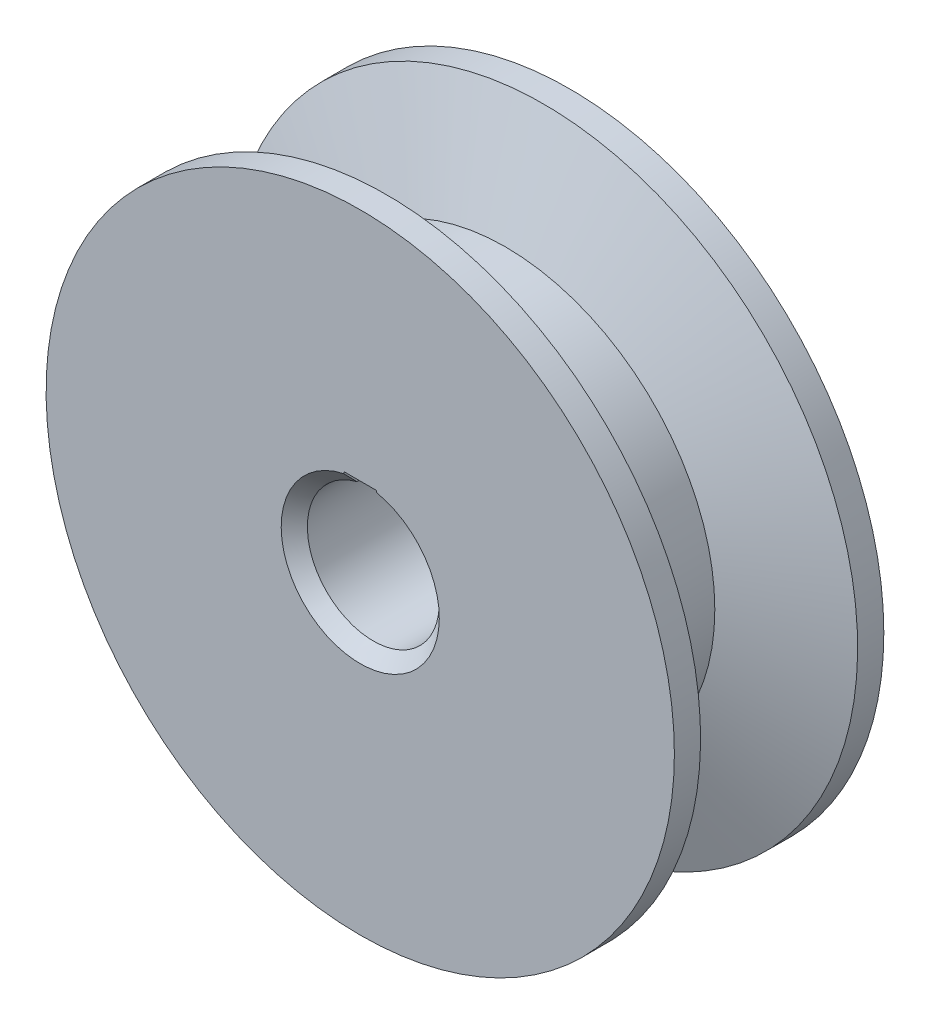
from build123d import *

# Parameters (mm, degrees)
SKETCH1_R          = 19.05
SKETCH1_R_2        = 4
EXTRUDE1_DEPTH     = 6.35
CHAMFER1_SIZE      = 0.79375
SKETCH3_W          = 2
SKETCH3_H          = 2
CUT_EXTRUDE1_DEPTH = 30.784140075


with BuildPart() as part:
    # Sketch1 → Extrude1 (new, symmetric)
    with BuildSketch(Plane.XY):
        Circle(SKETCH1_R)
        Circle(SKETCH1_R_2, mode=Mode.SUBTRACT)
    extrude(amount=EXTRUDE1_DEPTH, both=True)

    # Chamfer1
    chamfer1_edges = [part.edges().sort_by_distance(p)[0] for p in [
        (-4, 0, -6.35),
        (-4, 0, 6.35),
    ]]
    chamfer(chamfer1_edges, length=CHAMFER1_SIZE)

    # Sketch2 → Cut-Revolve1 (revolve, cut)
    with BuildSketch(Plane(origin=(0, 0, 0), x_dir=(0, 0, -1), z_dir=(1, 0, 0)), mode=Mode.PRIVATE) as cut_revolve1_sk:
        Polygon((-4.7625, 19.05), (4.7625, 19.05), (2.451289012, 12.7), (-2.451289012, 12.7), align=None)
    revolve(cut_revolve1_sk.sketch.rotate(Axis((0, 0, 6.35), (0, 0, -1)), 180), axis=Axis((0, 0, 6.35), (0, 0, -1)), mode=Mode.SUBTRACT)

    # Sketch3 → Cut-Extrude1 (cut, through all)
    with BuildSketch(Plane.XY.offset(6.35)):
        with Locations((0, 3.8)):
            Rectangle(SKETCH3_W, SKETCH3_H)
    extrude(amount=-CUT_EXTRUDE1_DEPTH, mode=Mode.SUBTRACT)


solid = part.part
